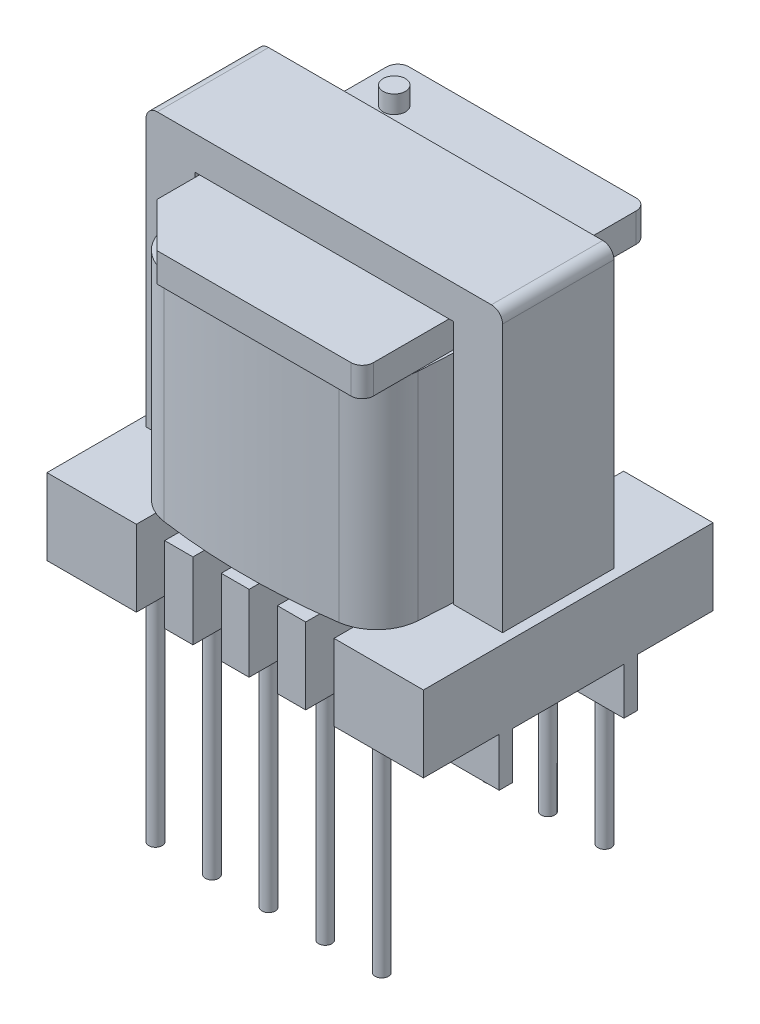
from build123d import *

# Parameters (mm, degrees)
SKETCH_2_W              = 16
SKETCH_2_H              = 5
EXTRUDE_1_DEPTH         = 14.5
SKETCH_3_W              = 11.6
SKETCH_3_H              = 11.5
CUT_EXTRUDE_2_DEPTH     = 18.298843892
EXTRUDE_3_DEPTH         = 1.3
EXTRUDE_7_DEPTH         = 0.5
EXTRUDE_7_DEPTH_BACK    = 5.1
SKETCH_6_W              = 16.9
SKETCH_6_H              = 13
CORTAR_EXTRUIR1_REACH   = 25.197
CROQUIS1_W              = 5
CROQUIS1_H              = 2.618972118
CROQUIS1_W_2            = 4.180401644
CROQUIS1_H_2            = 2.699558885
CROQUIS1_W_3            = 4.970986267
CUT_EXTRUDE_10_REACH    = 21.728
EXTRUDE_19_DEPTH        = 9.7
FILLET_1_R              = 2
REDONDEO1_R             = 0.5
SKETCH_19_R             = 0.5
EXTRUDE_20_DEPTH        = 0.8
CROQUIS2_W              = 1.27
CROQUIS2_H              = 3.5
CORTAR_EXTRUIR2_DEPTH   = 3.419413
CROQUIS3_R              = 0.3
SALIENTE_EXTRUIR1_DEPTH = 10


with BuildPart() as part:
    # Эскиз2 → Вытянуть1 (new body)
    with BuildSketch(Plane(origin=(0, 0, 0), x_dir=(1, 0, 0), z_dir=(0, 1, 0))):
        Rectangle(SKETCH_2_W, SKETCH_2_H)
    extrude(amount=EXTRUDE_1_DEPTH)

    # Эскиз3 → Вытянуть2 (cut, through all)
    with BuildSketch(Plane.XY.offset(2.5)):
        with Locations((0, 7.25)):
            Rectangle(SKETCH_3_W, SKETCH_3_H)
    extrude(amount=-CUT_EXTRUDE_2_DEPTH, mode=Mode.SUBTRACT)

    # Эскиз4 → Вытянуть3 (add)
    with BuildSketch(Plane.XZ.offset(-13)):
        with BuildLine():
            Line((-5.1, -6.4), (5.1, -6.4))
            ThreePointArc((5.1, -6.4), (5.453553391, -6.253553391), (5.6, -5.9))
            Line((5.6, -5.9), (5.6, 5.9))
            ThreePointArc((5.6, 5.9), (5.453553391, 6.253553391), (5.1, 6.4))
            Line((5.1, 6.4), (-5.6, 6.4))
            Line((-5.6, 6.4), (-5.6, -5.9))
            ThreePointArc((-5.6, -5.9), (-5.453553391, -6.253553391), (-5.1, -6.4))
        make_face()
    extrude(amount=EXTRUDE_3_DEPTH)

    # Эскиз6 → Вытянуть7 (add, two sides: drawn at the far end of the back side and taken through both)
    with BuildSketch(Plane(origin=(0, 1.5, 0), x_dir=(-1, 0, 0), z_dir=(0, 1, 0)).offset(-EXTRUDE_7_DEPTH_BACK)):
        Rectangle(SKETCH_6_W, SKETCH_6_H)
    extrude(amount=EXTRUDE_7_DEPTH + EXTRUDE_7_DEPTH_BACK)

    # Croquis1 → Cortar-Extruir1 (cut, up to next)
    with BuildSketch(Plane.ZY.offset(8.45), mode=Mode.PRIVATE) as cortar_extruir1_sk1:
        with Locations((0, -2.809486059)):
            Rectangle(CROQUIS1_W, CROQUIS1_H)
    cortar_extruir1_tool1 = extrude(cortar_extruir1_sk1.sketch, amount=-CORTAR_EXTRUIR1_REACH, mode=Mode.PRIVATE) & part.part
    # Croquis1 → Cortar-Extruir1 (cut, up to next)
    with BuildSketch(Plane.ZY.offset(8.45), mode=Mode.PRIVATE) as cortar_extruir1_sk2:
        with Locations((5.190200822, -2.769192676)):
            Rectangle(CROQUIS1_W_2, CROQUIS1_H_2)
    cortar_extruir1_tool2 = extrude(cortar_extruir1_sk2.sketch, amount=-CORTAR_EXTRUIR1_REACH, mode=Mode.PRIVATE) & part.part
    # Croquis1 → Cortar-Extruir1 (cut, up to next)
    with BuildSketch(Plane.ZY.offset(8.45), mode=Mode.PRIVATE) as cortar_extruir1_sk3:
        with Locations((-5.585493133, -2.769192676)):
            Rectangle(CROQUIS1_W_3, CROQUIS1_H_2)
    cortar_extruir1_tool3 = extrude(cortar_extruir1_sk3.sketch, amount=-CORTAR_EXTRUIR1_REACH, mode=Mode.PRIVATE) & part.part
    add(cortar_extruir1_tool1.solids().sort_by_distance((-8.45, -2.809486, 0))[0], mode=Mode.SUBTRACT)
    add(cortar_extruir1_tool2.solids().sort_by_distance((-8.45, -2.769193, 5.190201))[0], mode=Mode.SUBTRACT)
    add(cortar_extruir1_tool3.solids().sort_by_distance((-8.45, -2.769193, -5.585493))[0], mode=Mode.SUBTRACT)

    # Эскиз11 → Вытянуть10 (cut, up to next)
    with BuildSketch(Plane(origin=(0, 13, 0), x_dir=(-1, 0, 0), z_dir=(0, 1, 0)), mode=Mode.PRIVATE) as cut_extrude_10_sk1:
        Polygon((5.6, 4.4), (3.6, 6.4), (5.6, 6.4), align=None)
    cut_extrude_10_tool1 = extrude(cut_extrude_10_sk1.sketch, amount=-CUT_EXTRUDE_10_REACH, mode=Mode.PRIVATE) & part.part
    add(cut_extrude_10_tool1.solids().sort_by_distance((-4.933333, 13, 5.733333))[0], mode=Mode.SUBTRACT)

    # Redondeo1
    redondeo1_edges = [part.edges().sort_by_distance(p)[0] for p in [
        (-8, 14.5, 0),
        (8, 14.5, 0),
    ]]
    fillet(redondeo1_edges, radius=REDONDEO1_R)

    # Эскиз19 → Вытянуть20 (add)
    with BuildSketch(Plane(origin=(0, 13, 0), x_dir=(-1, 0, 0), z_dir=(0, 1, 0))):
        with Locations(Location((3.924240872, -4.564485884, 0), (0, 0, 90))):
            Circle(SKETCH_19_R)
    extrude(amount=EXTRUDE_20_DEPTH)

    # Croquis2 → Cortar-Extruir2 (cut)
    with BuildSketch(Plane.XZ.offset(1.419413233)):
        with Locations((1.26, -5.230358176)):
            Rectangle(CROQUIS2_W, CROQUIS2_H)
        with Locations((-1.26, -5.230358176)):
            Rectangle(CROQUIS2_W, CROQUIS2_H)
        with Locations((-3.8, -5.230358176)):
            Rectangle(CROQUIS2_W, CROQUIS2_H)
        with Locations((3.8, -5.230358176)):
            Rectangle(CROQUIS2_W, CROQUIS2_H)
        with Locations((3.8, 5.230358176)):
            Rectangle(CROQUIS2_W, CROQUIS2_H)
        with Locations((1.26, 5.230358176)):
            Rectangle(CROQUIS2_W, CROQUIS2_H)
        with Locations((-1.26, 5.230358176)):
            Rectangle(CROQUIS2_W, CROQUIS2_H)
        with Locations((-3.8, 5.230358176)):
            Rectangle(CROQUIS2_W, CROQUIS2_H)
    extrude(amount=-CORTAR_EXTRUIR2_DEPTH, mode=Mode.SUBTRACT)

    # Croquis3 → Saliente-Extruir1 (add)
    with BuildSketch(Plane.XZ.offset(1.419413233)):
        with Locations(Location((0, 5, 0), (0, 0, 180))):
            Circle(CROQUIS3_R)
        with Locations(Location((2.54, 5, 0), (0, 0, 180))):
            Circle(CROQUIS3_R)
        with Locations(Location((5.08, 5, 0), (0, 0, 180))):
            Circle(CROQUIS3_R)
        with Locations(Location((-2.54, 5, 0), (0, 0, 180))):
            Circle(CROQUIS3_R)
        with Locations(Location((-5.08, 5, 0), (0, 0, 180))):
            Circle(CROQUIS3_R)
        with Locations(Location((5.08, -5, 0), (0, 0, 180))):
            Circle(CROQUIS3_R)
        with Locations(Location((2.54, -5, 0), (0, 0, 180))):
            Circle(CROQUIS3_R)
        with Locations(Location((0, -5, 0), (0, 0, 180))):
            Circle(CROQUIS3_R)
        with Locations(Location((-2.54, -5, 0), (0, 0, 180))):
            Circle(CROQUIS3_R)
    extrude(amount=SALIENTE_EXTRUIR1_DEPTH)


with BuildPart() as body_2:
    # Эскиз18 → Вытянуть19 (new body)
    with BuildSketch(Plane(origin=(0, 2, 0), x_dir=(-1, 0, 0), z_dir=(0, 1, 0))):
        with BuildLine():
            ThreePointArc((5.5, -5.5), (0, -6.052149071), (-5.5, -5.5))
            ThreePointArc((-5.5, -5.5), (-5.781967238, 0), (-5.5, 5.5))
            ThreePointArc((-5.5, 5.5), (0, 6.052149071), (5.5, 5.5))
            ThreePointArc((5.5, 5.5), (5.781967238, 0), (5.5, -5.5))
        make_face()
    extrude(amount=EXTRUDE_19_DEPTH)

    # Скругление1
    fillet_1_edges = [body_2.edges().sort_by_distance(p)[0] for p in [
        (-5.5, 6.85, 5.5),
        (-5.5, 6.85, -5.5),
        (5.5, 6.85, -5.5),
        (5.5, 6.85, 5.5),
    ]]
    fillet(fillet_1_edges, radius=FILLET_1_R)


solid = Compound([part.part, body_2.part])
